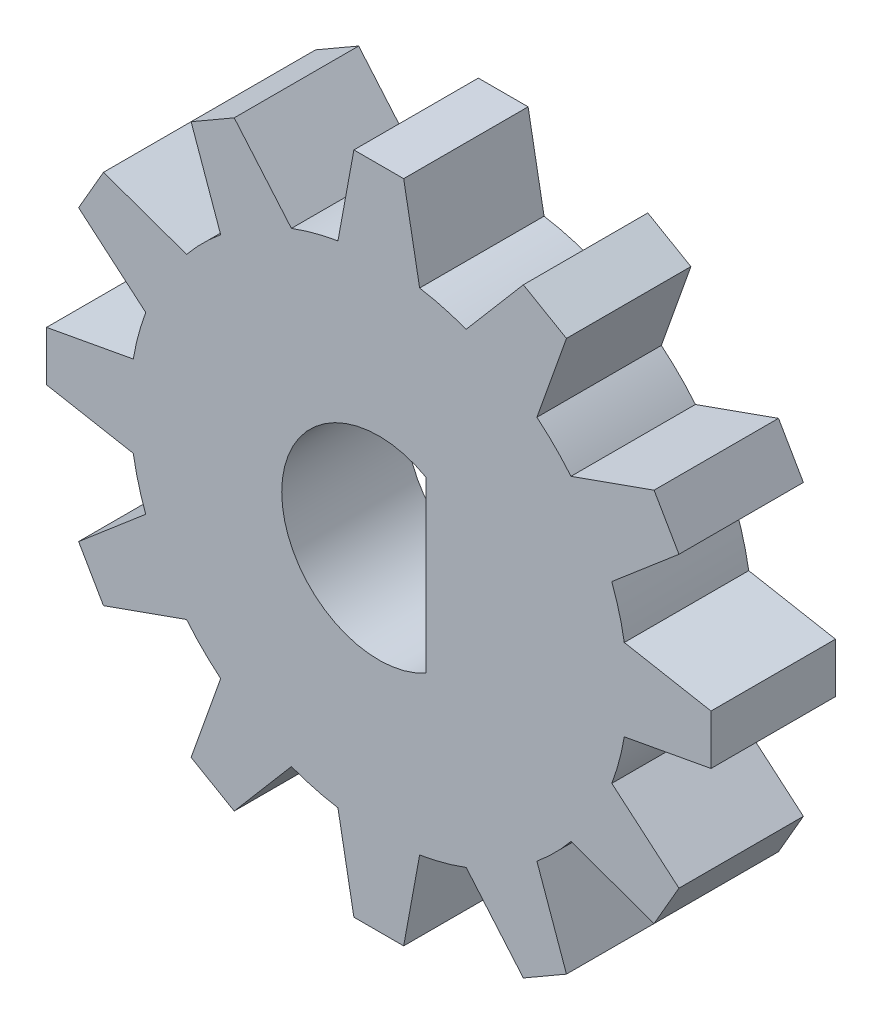
from build123d import *

# Parameters (mm, degrees)
SKETCH1_R           = 10
BOSS_EXTRUDE1_DEPTH = 5
BOSS_EXTRUDE2_DEPTH = 5
CIRPATTERN1_COUNT   = 12
CUT_EXTRUDE1_DEPTH  = 7


with BuildPart() as part:
    # Sketch1 → Boss-Extrude1 (new body)
    with BuildSketch(Plane.XY):
        Circle(SKETCH1_R)
    extrude(amount=BOSS_EXTRUDE1_DEPTH)

    # Sketch3 → Boss-Extrude2 (add)
    with BuildSketch(Plane.XY):
        Polygon((-1, 13.35), (1, 13.35), (1.8, 9), (-1.8, 9), align=None)
    boss_extrude2 = extrude(amount=BOSS_EXTRUDE2_DEPTH)

    # CirPattern1: Boss-Extrude2 ×12 about axis
    cirpattern1_axis = Axis((0, 0, 0), (0, 0, 1))
    for i in range(1, CIRPATTERN1_COUNT):
        add(boss_extrude2.rotate(cirpattern1_axis, i * 360 / CIRPATTERN1_COUNT))

    # Sketch4 → Cut-Extrude1 (cut)
    with BuildSketch(Plane.XY):
        with BuildLine():
            Line((1.9, 3.405877273), (1.9, -3.405877273))
            ThreePointArc((1.9, -3.405877273), (-3.9, 0), (1.9, 3.405877273))
        make_face()
    extrude(amount=CUT_EXTRUDE1_DEPTH, mode=Mode.SUBTRACT)


solid = part.part
